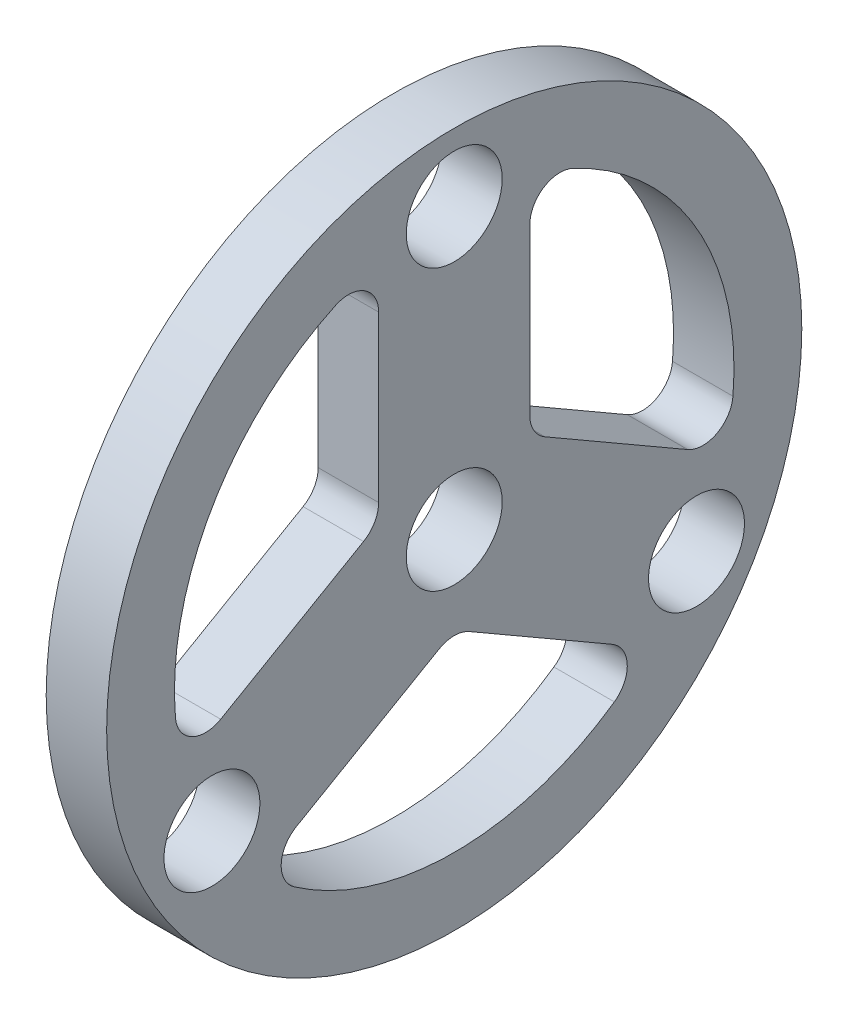
from build123d import *

# Parameters (mm, degrees)
SKETCH1_R           = 23
SKETCH1_R_2         = 3.175
BOSS_EXTRUDE1_DEPTH = 4


with BuildPart() as part:
    # Sketch1 → Boss-Extrude1 (new body)
    with BuildSketch(Plane(origin=(0, 0, 0), x_dir=(0, 0, -1), z_dir=(1, 0, 0))):
        Circle(SKETCH1_R)
        Circle(SKETCH1_R_2, mode=Mode.SUBTRACT)
        with Locations((0, 18.5125)):
            Circle(SKETCH1_R_2, mode=Mode.SUBTRACT)
        with Locations((16.032295288, -9.25625)):
            Circle(SKETCH1_R_2, mode=Mode.SUBTRACT)
        with Locations((-16.032295288, -9.25625)):
            Circle(SKETCH1_R_2, mode=Mode.SUBTRACT)
        with BuildLine():
            Line((6, 2.309401077), (15.451717731, -3.1475507))
            ThreePointArc((15.451717731, -3.1475507), (17.376490414, -3.188857015), (18.444355761, -1.586945753))
            ThreePointArc((18.444355761, -1.586945753), (16.032295288, 9.25625), (7.847842544, 16.766753522))
            ThreePointArc((7.847842544, 16.766753522), (5.926614023, 16.642910634), (5, 14.955355437))
            Line((5, 14.955355437), (5, 4.041451884))
            ThreePointArc((5, 4.041451884), (5.267949192, 3.041451884), (6, 2.309401077))
        make_face(mode=Mode.SUBTRACT)
        with BuildLine():
            Line((-5, 4.041451884), (-5, 14.955355437))
            ThreePointArc((-5, 14.955355437), (-5.926614023, 16.642910634), (-7.847842544, 16.766753522))
            ThreePointArc((-7.847842544, 16.766753522), (-16.032295288, 9.25625), (-18.444355761, -1.586945753))
            ThreePointArc((-18.444355761, -1.586945753), (-17.376490414, -3.188857015), (-15.451717731, -3.1475507))
            Line((-15.451717731, -3.1475507), (-6, 2.309401077))
            ThreePointArc((-6, 2.309401077), (-5.267949192, 3.041451884), (-5, 4.041451884))
        make_face(mode=Mode.SUBTRACT)
        with BuildLine():
            Line((-1, -6.350852961), (-10.451717731, -11.807804737))
            ThreePointArc((-10.451717731, -11.807804737), (-11.449876391, -13.454053619), (-10.596513217, -15.179807769))
            ThreePointArc((-10.596513217, -15.179807769), (0, -18.5125), (10.596513217, -15.179807769))
            ThreePointArc((10.596513217, -15.179807769), (11.449876391, -13.454053619), (10.451717731, -11.807804737))
            Line((10.451717731, -11.807804737), (1, -6.350852961))
            ThreePointArc((1, -6.350852961), (0, -6.082903769), (-1, -6.350852961))
        make_face(mode=Mode.SUBTRACT)
    extrude(amount=BOSS_EXTRUDE1_DEPTH)


solid = part.part
